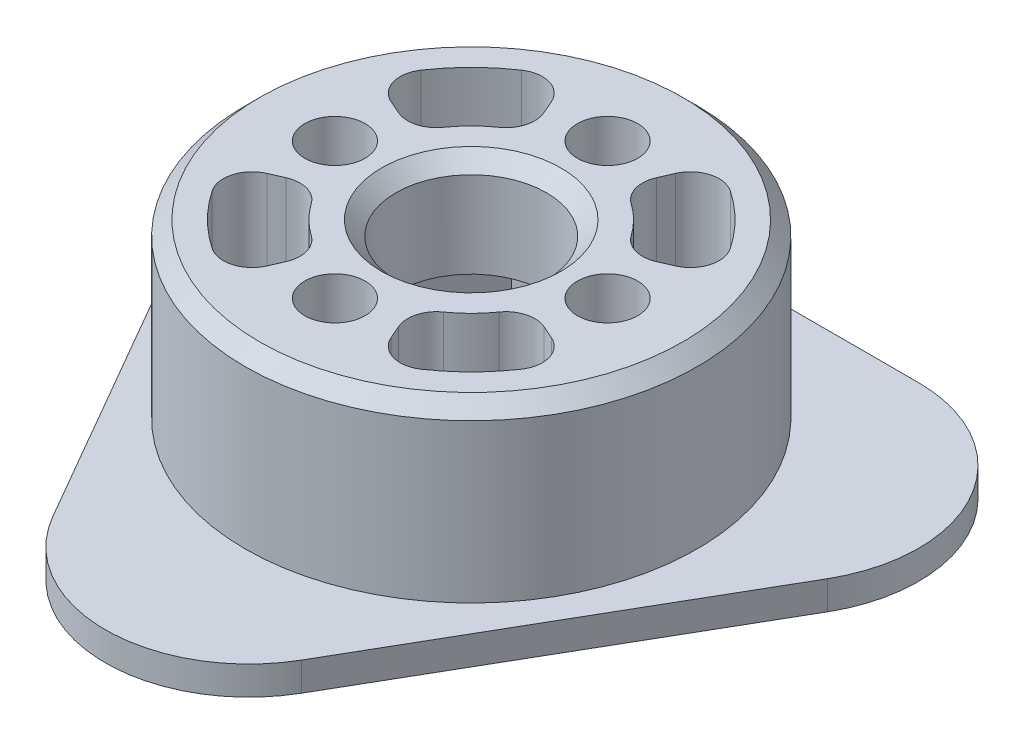
from build123d import *
from build123d.topology import SkipClean

# Parameters (mm, degrees)
SKETCH_1_R          = 15.75
SKETCH_1_R_2        = 5.25
EXTRUDE_1_DEPTH     = 12
EXTRUDE_START       = 2
SKETCH_2_R          = 5.25
EXTRUDE_2_DEPTH     = 2
CUT_EXTRUDE_1_DEPTH = 7
SKETCH_5_R          = 1.1
CUT_EXTRUDE_2_DEPTH = 38.348432031
SKETCH_6_R          = 2.1
CUT_EXTRUDE_3_DEPTH = 5
CHAMFER_1_SIZE      = 1
CUT_EXTRUDE_4_DEPTH = 38.348432031
FILLET_1_R          = 2


with BuildPart() as part:
    # Эскиз1 → Бобышка-Вытянуть1 (new body)
    with BuildSketch(Plane(origin=(0, 0, 0), x_dir=(1, 0, 0), z_dir=(0, 1, 0))):
        with Locations(Location((0, 0, 0), (0, 0, 270))):
            Circle(SKETCH_1_R)
        with Locations(Location((0, 0, 0), (0, 0, 270))):
            Circle(SKETCH_1_R_2, mode=Mode.SUBTRACT)
    extrude(amount=EXTRUDE_1_DEPTH)

    # Эскиз2 → Бобышка-Вытянуть2 (add)
    with SkipClean():  # the faces are left unmerged after this step: merging them gives an invalid solid
        with BuildSketch(Plane.XZ.offset(EXTRUDE_START)):
            with BuildLine():
                Line((-8.660254038, 20.5), (-22.083647797, -2.75))
                ThreePointArc((-22.083647797, -2.75), (-22.083647797, -12.75), (-13.423393759, -17.75))
                Line((-13.423393759, -17.75), (13.423393759, -17.75))
                ThreePointArc((13.423393759, -17.75), (22.083647797, -12.75), (22.083647797, -2.75))
                Line((22.083647797, -2.75), (8.660254038, 20.5))
                ThreePointArc((8.660254038, 20.5), (0, 25.5), (-8.660254038, 20.5))
            make_face()
            with Locations(Location((0, 0, 0), (0, 0, 270))):
                Circle(SKETCH_2_R, mode=Mode.SUBTRACT)
        extrude(amount=-EXTRUDE_2_DEPTH)

    # Эскиз3 → Вырез-Вытянуть1 (cut)
    with BuildSketch(Plane.XZ.offset(2)):
        Polygon((3.810511777, 6.6), (-3.810511777, 6.6), (-7.621023553, 0), (-3.810511777, -6.6), (3.810511777, -6.6), (7.621023553, 0), align=None)
    extrude(amount=-CUT_EXTRUDE_1_DEPTH, mode=Mode.SUBTRACT)

    # Эскиз5 → Вырез-Вытянуть2 (cut, through all)
    with BuildSketch(Plane(origin=(0, 12, 0), x_dir=(1, 0, 0), z_dir=(0, 1, 0))):
        with Locations(Location((0, 9.5, 0), (0, 0, 270))):
            Circle(SKETCH_5_R)
        with Locations(Location((9.5, 0, 0), (0, 0, 270))):
            Circle(SKETCH_5_R)
        with Locations(Location((0, -9.5, 0), (0, 0, 270))):
            Circle(SKETCH_5_R)
        with Locations(Location((-9.5, 0, 0), (0, 0, 270))):
            Circle(SKETCH_5_R)
    extrude(amount=-CUT_EXTRUDE_2_DEPTH, mode=Mode.SUBTRACT)

    # Эскиз6 → Вырез-Вытянуть3 (cut)
    with BuildSketch(Plane(origin=(0, 12, 0), x_dir=(1, 0, 0), z_dir=(0, 1, 0))):
        with Locations(Location((0, 9.5, 0), (0, 0, 270))):
            Circle(SKETCH_6_R)
        with Locations(Location((9.5, 0, 0), (0, 0, 270))):
            Circle(SKETCH_6_R)
        with Locations(Location((0, -9.5, 0), (0, 0, 270))):
            Circle(SKETCH_6_R)
        with Locations(Location((-9.5, 0, 0), (0, 0, 270))):
            Circle(SKETCH_6_R)
    extrude(amount=-CUT_EXTRUDE_3_DEPTH, mode=Mode.SUBTRACT)

    # Фаска1
    chamfer_1_edges = [part.edges().sort_by_distance(p)[0] for p in [
        (0, 12, -15.75),
        (0, 12, -5.25),
    ]]
    chamfer(chamfer_1_edges, length=CHAMFER_1_SIZE)

    # Эскиз7 → Вырез-Вытянуть4 (cut, through all)
    with BuildSketch(Plane(origin=(0, 12, 0), x_dir=(1, 0, 0), z_dir=(0, 1, 0))):
        with BuildLine():
            Line((5.2, 11.914696807), (3.2, 7.332121112))
            ThreePointArc((3.2, 7.332121112), (5.656854249, 5.656854249), (7.332121112, 3.2))
            Line((7.332121112, 3.2), (11.914696807, 5.2))
            ThreePointArc((11.914696807, 5.2), (9.192388155, 9.192388155), (5.2, 11.914696807))
        make_face()
        with BuildLine():
            Line((11.914696807, -5.2), (7.332121112, -3.2))
            ThreePointArc((7.332121112, -3.2), (5.656854249, -5.656854249), (3.2, -7.332121112))
            Line((3.2, -7.332121112), (5.2, -11.914696807))
            ThreePointArc((5.2, -11.914696807), (9.192388155, -9.192388155), (11.914696807, -5.2))
        make_face()
        with BuildLine():
            Line((-5.2, -11.914696807), (-3.2, -7.332121112))
            ThreePointArc((-3.2, -7.332121112), (-5.656854249, -5.656854249), (-7.332121112, -3.2))
            Line((-7.332121112, -3.2), (-11.914696807, -5.2))
            ThreePointArc((-11.914696807, -5.2), (-9.192388155, -9.192388155), (-5.2, -11.914696807))
        make_face()
        with BuildLine():
            Line((-11.914696807, 5.2), (-7.332121112, 3.2))
            ThreePointArc((-7.332121112, 3.2), (-5.656854249, 5.656854249), (-3.2, 7.332121112))
            Line((-3.2, 7.332121112), (-5.2, 11.914696807))
            ThreePointArc((-5.2, 11.914696807), (-9.192388155, 9.192388155), (-11.914696807, 5.2))
        make_face()
    extrude(amount=-CUT_EXTRUDE_4_DEPTH, mode=Mode.SUBTRACT)

    # Скругление1
    fillet_1_edges = [part.edges().sort_by_distance(p)[0] for p in [
        (-5.2, 5, -11.914696807),
        (-3.2, 5, -7.332121112),
        (-7.332121112, 5, -3.2),
        (-11.914696807, 5, -5.2),
        (-11.914696807, 5, 5.2),
        (-7.332121112, 5, 3.2),
        (-3.2, 5, 7.332121112),
        (-5.2, 5, 11.914696807),
        (5.2, 5, 11.914696807),
        (3.2, 5, 7.332121112),
        (7.332121112, 5, 3.2),
        (11.914696807, 5, 5.2),
        (11.914696807, 5, -5.2),
        (7.332121112, 5, -3.2),
        (3.2, 5, -7.332121112),
        (5.2, 5, -11.914696807),
    ]]
    fillet(fillet_1_edges, radius=FILLET_1_R)


solid = part.part
